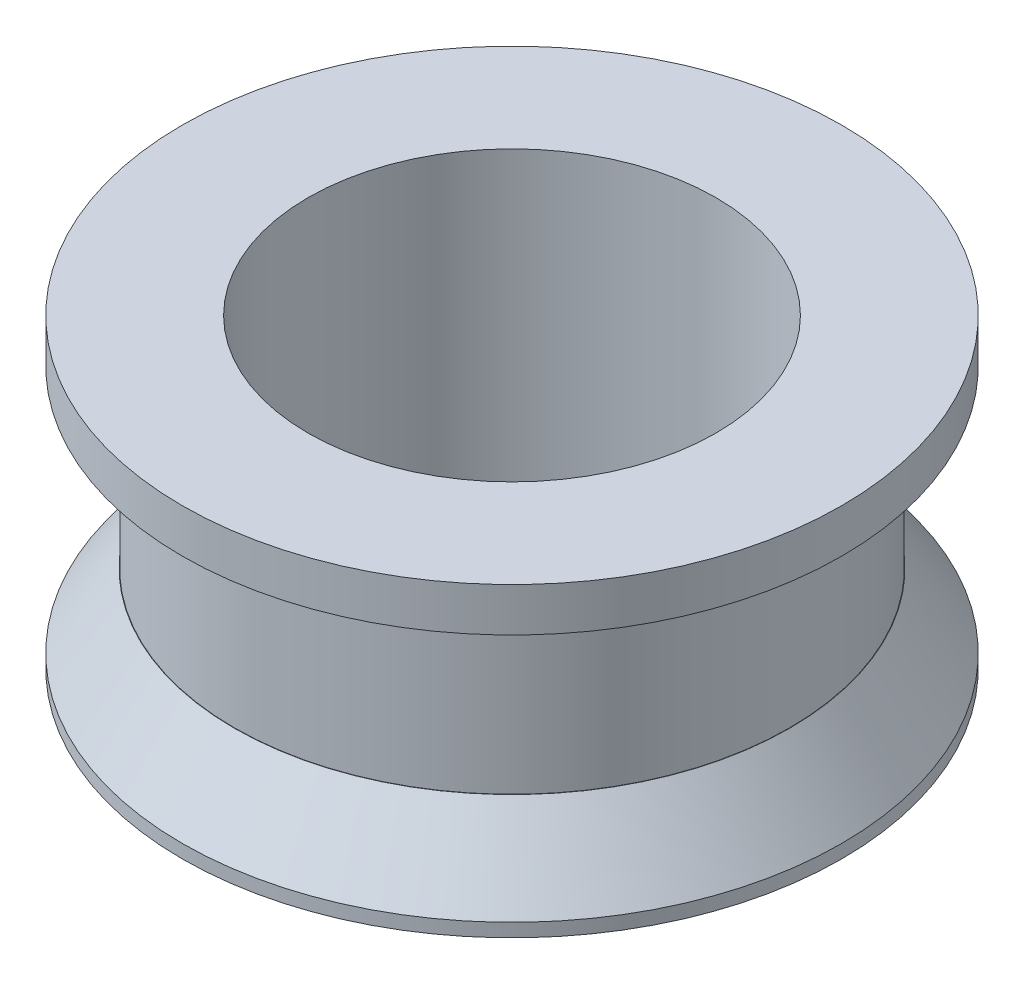
from build123d import *

# Parameters (mm, degrees)
SKETCH1_R           = 9.525
SKETCH1_R_2         = 7
BOSS_EXTRUDE1_DEPTH = 6
SKETCH2_R           = 11.31575364
SKETCH2_R_2         = 7
BOSS_EXTRUDE2_DEPTH = 1.5
BOSS_EXTRUDE4_START = 3
SKETCH3_R           = 11.31575364
SKETCH3_R_2         = 7
BOSS_EXTRUDE4_DEPTH = 3
CHAMFER4_SIZE       = 1.778
CHAMFER4_SIZE2      = 2.539247156


with BuildPart() as part:
    # Sketch1 → Boss-Extrude1 (new body)
    with BuildSketch(Plane(origin=(0, 0, 0), x_dir=(1, 0, 0), z_dir=(0, 1, 0))):
        with Locations(Location((0, 0, 0), (0, 0, 270))):
            Circle(SKETCH1_R)
        with Locations(Location((0, 0, 0), (0, 0, 270))):
            Circle(SKETCH1_R_2, mode=Mode.SUBTRACT)
    extrude(amount=BOSS_EXTRUDE1_DEPTH)

    # Sketch2 → Boss-Extrude2 (add)
    with BuildSketch(Plane(origin=(0, 6, 0), x_dir=(1, 0, 0), z_dir=(0, 1, 0))):
        with Locations(Location((0, 0, 0), (0, 0, 270))):
            Circle(SKETCH2_R)
        with Locations(Location((0, 0, 0), (0, 0, 270))):
            Circle(SKETCH2_R_2, mode=Mode.SUBTRACT)
    extrude(amount=BOSS_EXTRUDE2_DEPTH)

    # Sketch3 → Boss-Extrude4 (add)
    with BuildSketch(Plane.XZ.offset(BOSS_EXTRUDE4_START)):
        with Locations(Location((0, 0, 0), (0, 0, 90))):
            Circle(SKETCH3_R)
        with Locations(Location((0, 0, 0), (0, 0, 270))):
            Circle(SKETCH3_R_2, mode=Mode.SUBTRACT)
    extrude(amount=-BOSS_EXTRUDE4_DEPTH)

    # Chamfer4
    chamfer4_edges = [part.edges().sort_by_distance(p)[0] for p in [
        (0, 0, -11.31575364),
    ]]
    chamfer4_side = [part.faces().sort_by_distance(p)[0] for p in [
        (0, 0, -10.995695794),
    ]]
    chamfer(chamfer4_edges, length=CHAMFER4_SIZE, length2=CHAMFER4_SIZE2, reference=chamfer4_side[0])


solid = part.part
